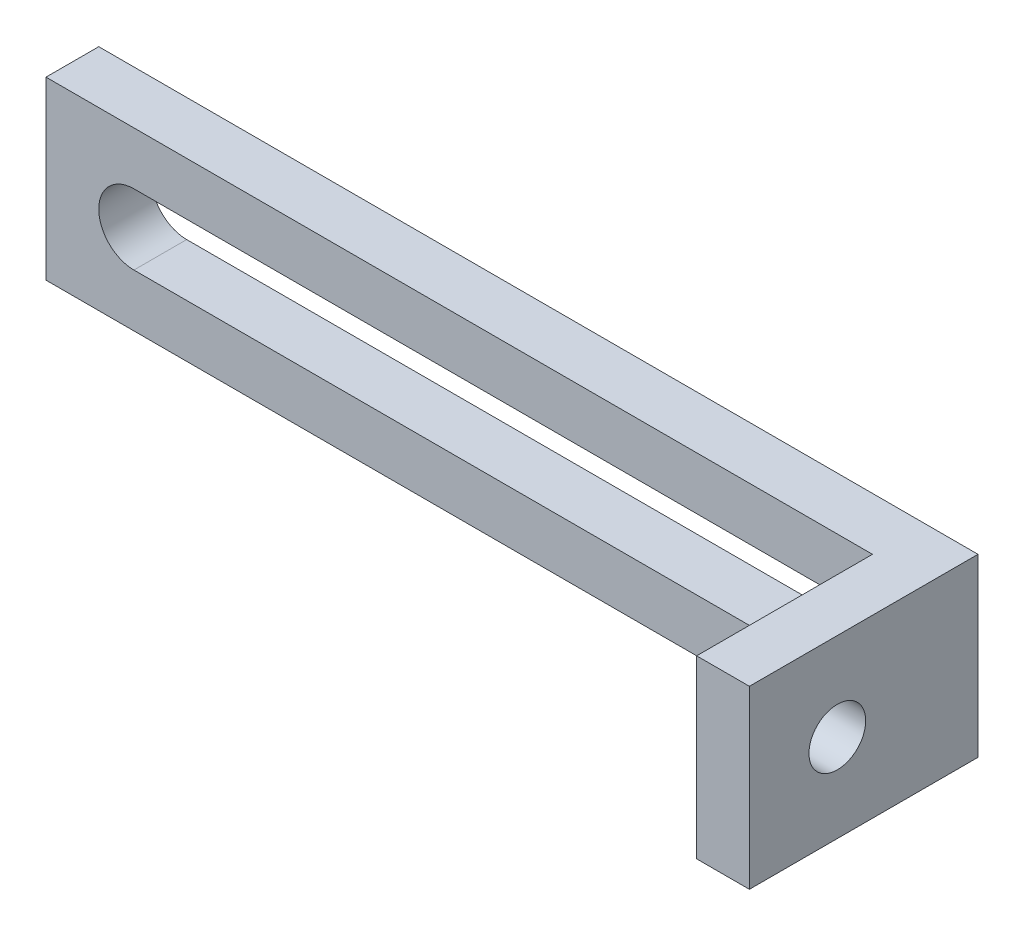
from build123d import *

# Parameters (mm, degrees)
SKETCH1_W           = 50
SKETCH1_H           = 10
BOSS_EXTRUDE1_DEPTH = 3
SKETCH2_W           = 3
SKETCH2_H           = 10
BOSS_EXTRUDE2_DEPTH = 10
SKETCH3_R           = 1.614445202
CUT_EXTRUDE1_DEPTH  = 10
CUT_EXTRUDE2_DEPTH  = 10


with BuildPart() as part:
    # Sketch1 → Boss-Extrude1 (new body)
    with BuildSketch(Plane.XY):
        Rectangle(SKETCH1_W, SKETCH1_H)
    extrude(amount=BOSS_EXTRUDE1_DEPTH)

    # Sketch2 → Boss-Extrude2 (add)
    with BuildSketch(Plane.XY.offset(3)):
        with Locations((23.5, 0)):
            Rectangle(SKETCH2_W, SKETCH2_H)
    extrude(amount=BOSS_EXTRUDE2_DEPTH)

    # Sketch3 → Cut-Extrude1 (cut)
    with BuildSketch(Plane(origin=(25, 0, 0), x_dir=(0, 0, -1), z_dir=(1, 0, 0))):
        with Locations((-8, 0)):
            Circle(SKETCH3_R)
    extrude(amount=-CUT_EXTRUDE1_DEPTH, mode=Mode.SUBTRACT)

    # Sketch5 → Cut-Extrude2 (cut)
    with BuildSketch(Plane(origin=(0, 0, 0), x_dir=(-1, 0, 0), z_dir=(0, 0, -1))):
        with BuildLine():
            Line((20, -2), (-20.306358663, -2))
            ThreePointArc((-20.306358663, -2), (-22.306358663, 0), (-20.306358663, 2))
            Line((-20.306358663, 2), (20, 2))
            ThreePointArc((20, 2), (22, 0), (20, -2))
        make_face()
    extrude(amount=-CUT_EXTRUDE2_DEPTH, mode=Mode.SUBTRACT)


solid = part.part
